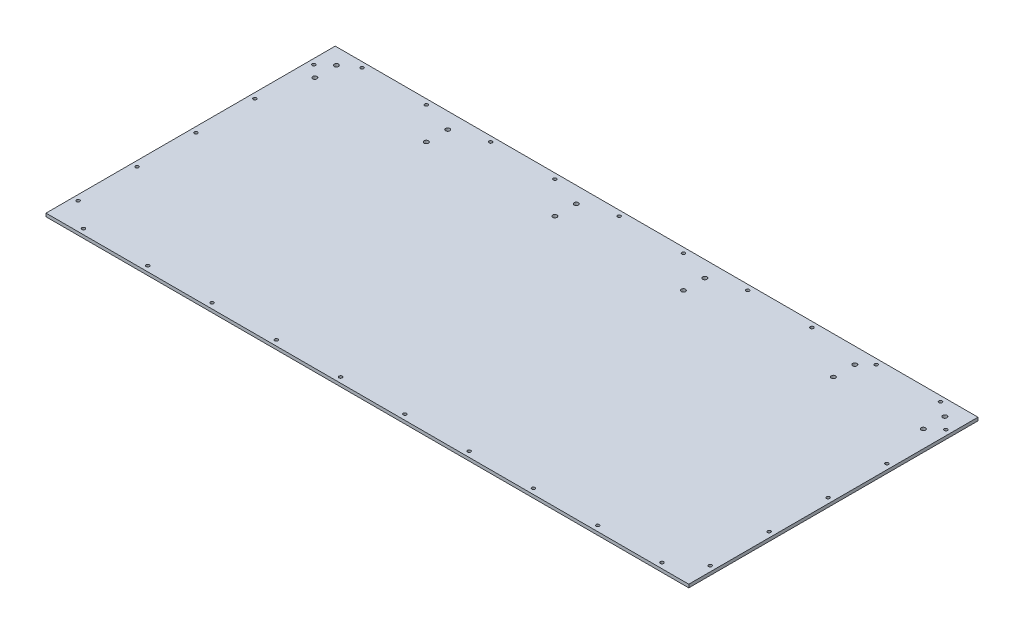
from build123d import *

# Parameters (mm, degrees)
SKETCH1_W           = 600
SKETCH1_H           = 270
EXTRUDE1_DEPTH      = 3
SKETCH17_R          = 2
CUT_EXTRUDE10_DEPTH = 636.695681911
SKETCH18_R          = 1.5
CUT_EXTRUDE11_DEPTH = 636.695681911
LPATTERN1_COUNT     = 10
LPATTERN1_PITCH     = 60
SKETCH19_R          = 1.5
CUT_EXTRUDE12_DEPTH = 636.695681911


with BuildPart() as part:
    # Sketch1 → Extrude1 (new body)
    with BuildSketch(Plane(origin=(0, 0, 0), x_dir=(1, 0, 0), z_dir=(0, 1, 0))):
        with Locations((300, 75)):
            Rectangle(SKETCH1_W, SKETCH1_H)
    extrude(amount=EXTRUDE1_DEPTH)

    # Sketch17 → Cut-Extrude10 (cut, through all)
    with BuildSketch(Plane(origin=(0, 3, 0), x_dir=(-1, 0, 0), z_dir=(0, 1, 0))):
        with Locations(Location((-16, -195, 0), (0, 0, 90))):
            Circle(SKETCH17_R)
        with Locations(Location((-16, -175, 0), (0, 0, 90))):
            Circle(SKETCH17_R)
        with Locations(Location((-584, -195, 0), (0, 0, 90))):
            Circle(SKETCH17_R)
        with Locations(Location((-584, -175, 0), (0, 0, 90))):
            Circle(SKETCH17_R)
        with Locations(Location((-120, -195, 0), (0, 0, 90))):
            Circle(SKETCH17_R)
        with Locations(Location((-120, -175, 0), (0, 0, 90))):
            Circle(SKETCH17_R)
        with Locations(Location((-240, -195, 0), (0, 0, 90))):
            Circle(SKETCH17_R)
        with Locations(Location((-240, -175, 0), (0, 0, 90))):
            Circle(SKETCH17_R)
        with Locations(Location((-360, -195, 0), (0, 0, 90))):
            Circle(SKETCH17_R)
        with Locations(Location((-360, -175, 0), (0, 0, 90))):
            Circle(SKETCH17_R)
        with Locations(Location((-500, -195, 0), (0, 0, 90))):
            Circle(SKETCH17_R)
        with Locations(Location((-500, -175, 0), (0, 0, 90))):
            Circle(SKETCH17_R)
    extrude(amount=-CUT_EXTRUDE10_DEPTH, mode=Mode.SUBTRACT)

    # Sketch18 → Cut-Extrude11 (cut, through all)
    with BuildSketch(Plane(origin=(0, 3, 0), x_dir=(-1, 0, 0), z_dir=(0, 1, 0))):
        with Locations(Location((-30, 55, 0), (0, 0, 90))):
            Circle(SKETCH18_R)
        with Locations(Location((-30, -205, 0), (0, 0, 90))):
            Circle(SKETCH18_R)
    cut_extrude11 = extrude(amount=-CUT_EXTRUDE11_DEPTH, mode=Mode.SUBTRACT)

    # LPattern1: Cut-Extrude11 ×10
    with Locations(*[(i * LPATTERN1_PITCH, 0, 0) for i in range(1, LPATTERN1_COUNT)]):
        add(cut_extrude11, mode=Mode.SUBTRACT)

    # Sketch19 → Cut-Extrude12 (cut, through all)
    with BuildSketch(Plane(origin=(0, 3, 0), x_dir=(-1, 0, 0), z_dir=(0, 1, 0))):
        with Locations(Location((-5, -185, 0), (0, 0, 90))):
            Circle(SKETCH19_R)
        with Locations(Location((-5, -130, 0), (0, 0, 90))):
            Circle(SKETCH19_R)
        with Locations(Location((-5, -75, 0), (0, 0, 90))):
            Circle(SKETCH19_R)
        with Locations(Location((-5, -20, 0), (0, 0, 90))):
            Circle(SKETCH19_R)
        with Locations(Location((-595, -185, 0), (0, 0, 90))):
            Circle(SKETCH19_R)
        with Locations(Location((-595, -130, 0), (0, 0, 90))):
            Circle(SKETCH19_R)
        with Locations(Location((-595, -75, 0), (0, 0, 90))):
            Circle(SKETCH19_R)
        with Locations(Location((-595, -20, 0), (0, 0, 90))):
            Circle(SKETCH19_R)
        with Locations(Location((-5, 35, 0), (0, 0, 90))):
            Circle(SKETCH19_R)
        with Locations(Location((-595, 35, 0), (0, 0, 90))):
            Circle(SKETCH19_R)
    extrude(amount=-CUT_EXTRUDE12_DEPTH, mode=Mode.SUBTRACT)


solid = part.part
